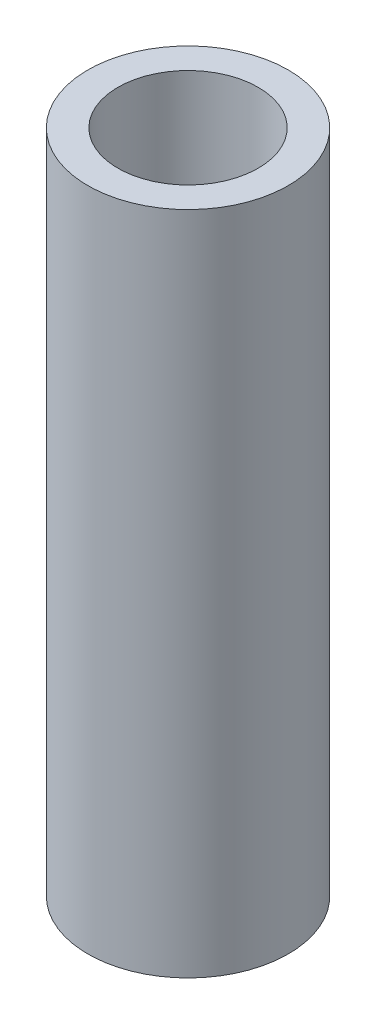
from build123d import *

# Parameters (mm, degrees)
SKETCH1_R           = 2.5
SKETCH1_R_2         = 1.75
BOSS_EXTRUDE1_DEPTH = 8.3


with BuildPart() as part:
    # Sketch1 → Boss-Extrude1 (new, symmetric)
    with BuildSketch(Plane(origin=(0, 0, 0), x_dir=(1, 0, 0), z_dir=(0, 1, 0))):
        with Locations(Location((0, 0, 0), (0, 0, 90))):
            Circle(SKETCH1_R)
        with Locations(Location((0, 0, 0), (0, 0, 90))):
            Circle(SKETCH1_R_2, mode=Mode.SUBTRACT)
    extrude(amount=BOSS_EXTRUDE1_DEPTH, both=True)


solid = part.part
